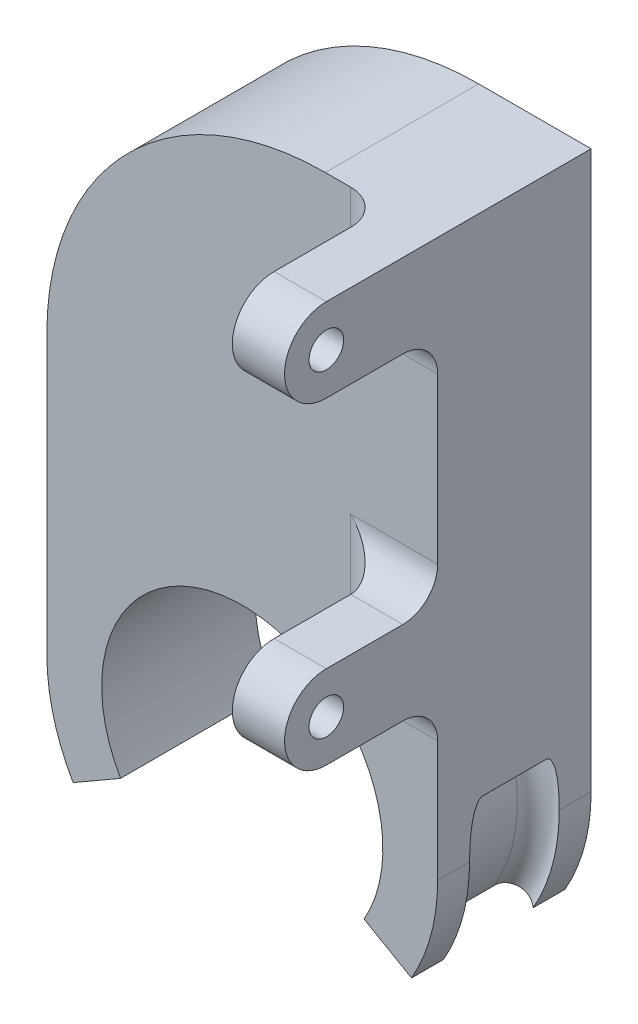
from build123d import *

# Parameters (mm, degrees)
BOSS_EXTRUDE2_DEPTH      = 7
CORTAR_REVOLUCI_N1_ANGLE = 270
CROQUIS3_R               = 3.81
CROQUIS3_R_2             = 1.575
SALIENTE_EXTRUIR2_DEPTH  = 4.7625
REDONDEO3_R              = 3.175
REDONDEO4_R              = 25.4


with BuildPart() as part:
    # Sketch1 → Boss-Extrude2 (new, symmetric)
    with BuildSketch(Plane.XY):
        with BuildLine():
            Line((-17.827, 50.8), (17.827, 50.8))
            Line((17.827, 50.8), (17.827, 0))
            ThreePointArc((17.827, 0), (17.219559705, -4.613967117), (15.438634873, -8.9135))
            Line((15.438634873, -8.9135), (11.108507854, -6.4135))
            ThreePointArc((11.108507854, -6.4135), (0, 12.827), (-11.108507854, -6.4135))
            Line((-11.108507854, -6.4135), (-15.438634873, -8.9135))
            ThreePointArc((-15.438634873, -8.9135), (-17.219559705, -4.613967117), (-17.827, 0))
            Line((-17.827, 0), (-17.827, 50.8))
        make_face()
    extrude(amount=BOSS_EXTRUDE2_DEPTH, both=True)

    # Croquis1 → Cortar-Revolución1 (revolve, symmetric, cut)
    with BuildSketch(Plane(origin=(0, 0, 0), x_dir=(0, 0, -1), z_dir=(1, 0, 0))) as cortar_revoluci_n1_sk:
        with BuildLine():
            Line((-2.8575, 18.415), (2.8575, 18.415))
            ThreePointArc((2.8575, 18.415), (4.445, 16.8275), (2.8575, 15.24))
            Line((2.8575, 15.24), (-2.8575, 15.24))
            ThreePointArc((-2.8575, 15.24), (-4.445, 16.8275), (-2.8575, 18.415))
        make_face()
    revolve(axis=Axis((0, 0, 0), (0, 0, 1)), revolution_arc=CORTAR_REVOLUCI_N1_ANGLE / 2, mode=Mode.SUBTRACT)
    revolve(cortar_revoluci_n1_sk.sketch, axis=Axis((0, 0, 0), (0, 0, -1)), revolution_arc=CORTAR_REVOLUCI_N1_ANGLE / 2, mode=Mode.SUBTRACT)

    # Croquis3 → Saliente-Extruir2 (add)
    # profile 1 of 4: a face of its own
    with BuildSketch(Plane(origin=(17.827, 0, 0), x_dir=(0, 0, -1), z_dir=(1, 0, 0))):
        with BuildLine():
            Line((-7, 14.18), (-7, 21.8))
            Line((-7, 21.8), (-17.16, 21.8))
            ThreePointArc((-17.16, 21.8), (-14.465923164, 20.684076836), (-13.35, 17.99))
            ThreePointArc((-13.35, 17.99), (-14.465923164, 15.295923164), (-17.16, 14.18))
            Line((-17.16, 14.18), (-7, 14.18))
        make_face()
    # profile 2 of 4: a face of its own
    with BuildSketch(Plane(origin=(17.827, 0, 0), x_dir=(0, 0, -1), z_dir=(1, 0, 0))):
        with Locations((-17.16, 17.99)):
            Circle(CROQUIS3_R)
        with Locations(Location((-17.16, 17.99, 0), (0, 0, 90))):
            Circle(CROQUIS3_R_2, mode=Mode.SUBTRACT)
    # profile 3 of 4: a face of its own
    with BuildSketch(Plane(origin=(17.827, 0, 0), x_dir=(0, 0, -1), z_dir=(1, 0, 0))):
        with BuildLine():
            Line((-7, 50.8), (-17.16, 50.8))
            ThreePointArc((-17.16, 50.8), (-14.465923164, 49.684076836), (-13.35, 46.99))
            ThreePointArc((-13.35, 46.99), (-14.465923164, 44.295923164), (-17.16, 43.18))
            Line((-17.16, 43.18), (-7, 43.18))
            Line((-7, 43.18), (-7, 50.8))
        make_face()
    # profile 4 of 4: a face of its own
    with BuildSketch(Plane(origin=(17.827, 0, 0), x_dir=(0, 0, -1), z_dir=(1, 0, 0))):
        with Locations((-17.16, 46.99)):
            Circle(CROQUIS3_R)
        with Locations(Location((-17.16, 46.99, 0), (0, 0, 90))):
            Circle(CROQUIS3_R_2, mode=Mode.SUBTRACT)
    extrude(amount=-SALIENTE_EXTRUIR2_DEPTH)

    # Redondeo3
    redondeo3_edges = [part.edges().sort_by_distance(p)[0] for p in [
        (15.44575, 21.8, 7),
        (15.44575, 14.18, 7),
        (13.0645, 17.99, 7),
        (15.44575, 43.18, 7),
        (13.0645, 46.99, 7),
    ]]
    fillet(redondeo3_edges, radius=REDONDEO3_R)

    # Redondeo4
    redondeo4_edges = [part.edges().sort_by_distance(p)[0] for p in [
        (-17.827, 50.8, 0),
    ]]
    fillet(redondeo4_edges, radius=REDONDEO4_R)


solid = part.part
